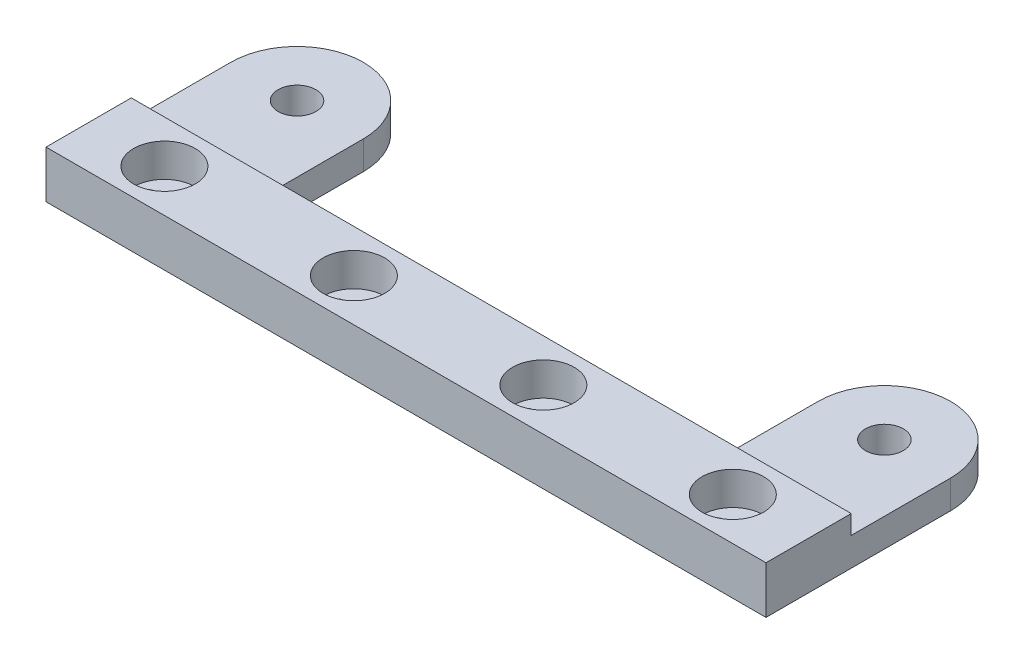
from build123d import *

# Parameters (mm, degrees)
SKETCH1_R           = 2
BOSS_EXTRUDE1_DEPTH = 3
SKETCH2_W           = 76
SKETCH2_H           = 9
BOSS_EXTRUDE2_DEPTH = 2
SKETCH3_R           = 3.25
CUT_EXTRUDE1_DEPTH  = 3.5
CUT_EXTRUDE2_REACH  = 82.564


with BuildPart() as part:
    # Sketch1 → Boss-Extrude1 (new body)
    with BuildSketch(Plane(origin=(0, 0, 0), x_dir=(1, 0, 0), z_dir=(0, 1, 0))):
        with BuildLine():
            ThreePointArc((76, 19.5), (69, 26.5), (62, 19.5))
            Line((62, 19.5), (62, 9))
            Line((62, 9), (14, 9))
            Line((14, 9), (14, 19.5))
            ThreePointArc((14, 19.5), (7, 26.5), (0, 19.5))
            Line((0, 19.5), (0, 0))
            Line((0, 0), (76, 0))
            Line((76, 0), (76, 19.5))
        make_face()
        with Locations(Location((69, 19.5, 0), (0, 0, 270))):
            Circle(SKETCH1_R, mode=Mode.SUBTRACT)
        with Locations(Location((7, 19.5, 0), (0, 0, 270))):
            Circle(SKETCH1_R, mode=Mode.SUBTRACT)
    extrude(amount=BOSS_EXTRUDE1_DEPTH)

    # Sketch2 → Boss-Extrude2 (add)
    with BuildSketch(Plane(origin=(0, 3, 0), x_dir=(1, 0, 0), z_dir=(0, 1, 0))):
        with Locations((38, 4.5)):
            Rectangle(SKETCH2_W, SKETCH2_H)
    extrude(amount=BOSS_EXTRUDE2_DEPTH)

    # Sketch3 → Cut-Extrude1 (cut)
    with BuildSketch(Plane(origin=(0, 5, 0), x_dir=(1, 0, 0), z_dir=(0, 1, 0))):
        with Locations(Location((8, 4.5, 0), (0, 0, 270))):
            Circle(SKETCH3_R)
        with Locations(Location((28, 4.5, 0), (0, 0, 270))):
            Circle(SKETCH3_R)
        with Locations(Location((48, 4.5, 0), (0, 0, 270))):
            Circle(SKETCH3_R)
        with Locations(Location((68, 4.5, 0), (0, 0, 270))):
            Circle(SKETCH3_R)
    extrude(amount=-CUT_EXTRUDE1_DEPTH, mode=Mode.SUBTRACT)

    # Sketch4 → Cut-Extrude2 (cut, up to next)
    with BuildSketch(Plane(origin=(0, 1.5, 0), x_dir=(1, 0, 0), z_dir=(0, 1, 0)), mode=Mode.PRIVATE) as cut_extrude2_sk1:
        with BuildLine():
            Line((6.25, 5.2), (9.75, 5.2))
            ThreePointArc((9.75, 5.2), (10.45, 4.5), (9.75, 3.8))
            Line((9.75, 3.8), (6.25, 3.8))
            ThreePointArc((6.25, 3.8), (5.55, 4.5), (6.25, 5.2))
        make_face()
    cut_extrude2_tool1 = extrude(cut_extrude2_sk1.sketch, amount=-CUT_EXTRUDE2_REACH, mode=Mode.PRIVATE) & part.part
    # Sketch4 → Cut-Extrude2 (cut, up to next)
    with BuildSketch(Plane(origin=(0, 1.5, 0), x_dir=(1, 0, 0), z_dir=(0, 1, 0)), mode=Mode.PRIVATE) as cut_extrude2_sk2:
        with BuildLine():
            Line((26.25, 5.2), (29.75, 5.2))
            ThreePointArc((29.75, 5.2), (30.45, 4.5), (29.75, 3.8))
            Line((29.75, 3.8), (26.25, 3.8))
            ThreePointArc((26.25, 3.8), (25.55, 4.5), (26.25, 5.2))
        make_face()
    cut_extrude2_tool2 = extrude(cut_extrude2_sk2.sketch, amount=-CUT_EXTRUDE2_REACH, mode=Mode.PRIVATE) & part.part
    # Sketch4 → Cut-Extrude2 (cut, up to next)
    with BuildSketch(Plane(origin=(0, 1.5, 0), x_dir=(1, 0, 0), z_dir=(0, 1, 0)), mode=Mode.PRIVATE) as cut_extrude2_sk3:
        with BuildLine():
            Line((46.25, 5.2), (49.75, 5.2))
            ThreePointArc((49.75, 5.2), (50.45, 4.5), (49.75, 3.8))
            Line((49.75, 3.8), (46.25, 3.8))
            ThreePointArc((46.25, 3.8), (45.55, 4.5), (46.25, 5.2))
        make_face()
    cut_extrude2_tool3 = extrude(cut_extrude2_sk3.sketch, amount=-CUT_EXTRUDE2_REACH, mode=Mode.PRIVATE) & part.part
    # Sketch4 → Cut-Extrude2 (cut, up to next)
    with BuildSketch(Plane(origin=(0, 1.5, 0), x_dir=(1, 0, 0), z_dir=(0, 1, 0)), mode=Mode.PRIVATE) as cut_extrude2_sk4:
        with BuildLine():
            Line((66.25, 5.2), (69.75, 5.2))
            ThreePointArc((69.75, 5.2), (70.45, 4.5), (69.75, 3.8))
            Line((69.75, 3.8), (66.25, 3.8))
            ThreePointArc((66.25, 3.8), (65.55, 4.5), (66.25, 5.2))
        make_face()
    cut_extrude2_tool4 = extrude(cut_extrude2_sk4.sketch, amount=-CUT_EXTRUDE2_REACH, mode=Mode.PRIVATE) & part.part
    add(cut_extrude2_tool1.solids().sort_by_distance((8, 1.5, -4.5))[0], mode=Mode.SUBTRACT)
    add(cut_extrude2_tool2.solids().sort_by_distance((28, 1.5, -4.5))[0], mode=Mode.SUBTRACT)
    add(cut_extrude2_tool3.solids().sort_by_distance((48, 1.5, -4.5))[0], mode=Mode.SUBTRACT)
    add(cut_extrude2_tool4.solids().sort_by_distance((68, 1.5, -4.5))[0], mode=Mode.SUBTRACT)


solid = part.part
